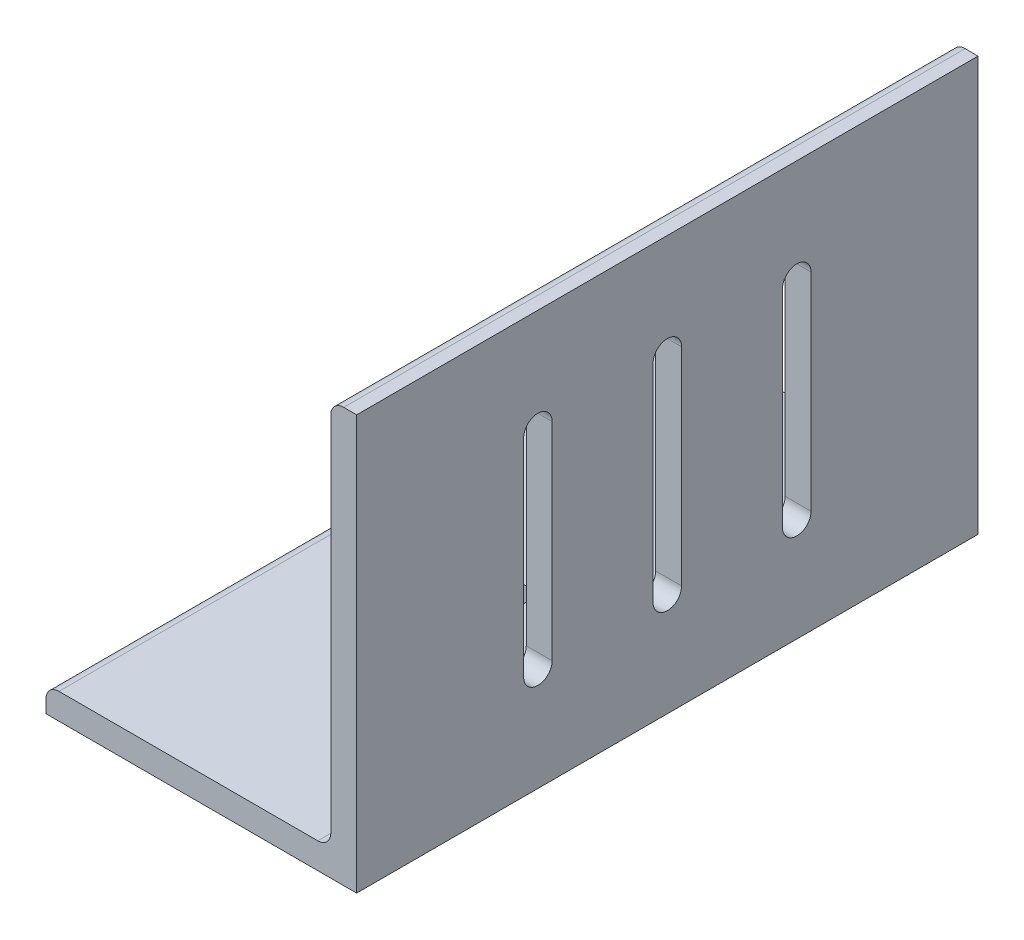
from build123d import *

# Parameters (mm, degrees)
BOSS_EXTRUDE1_DEPTH = 76.2
CUT_EXTRUDE1_DEPTH  = 10
SKETCH4_R           = 3.5
CUT_EXTRUDE2_DEPTH  = 10


with BuildPart() as part:
    # Sketch2 → Boss-Extrude1 (new, symmetric)
    with BuildSketch(Plane.XY):
        with BuildLine():
            Line((-38.1, 0), (38.1, 0))
            Line((38.1, 0), (38.1, 101.6))
            Line((38.1, 101.6), (34.925, 101.6))
            ThreePointArc((34.925, 101.6), (32.67993597, 100.67006403), (31.75, 98.425))
            Line((31.75, 98.425), (31.75, 9.525))
            ThreePointArc((31.75, 9.525), (30.82006403, 7.27993597), (28.575, 6.35))
            Line((28.575, 6.35), (-34.925, 6.35))
            ThreePointArc((-34.925, 6.35), (-37.17006403, 5.42006403), (-38.1, 3.175))
            Line((-38.1, 3.175), (-38.1, 0))
        make_face()
    extrude(amount=BOSS_EXTRUDE1_DEPTH, both=True)

    # Sketch3 → Cut-Extrude1 (cut)
    with BuildSketch(Plane(origin=(38.1, 0, 0), x_dir=(0, 0, -1), z_dir=(1, 0, 0))):
        with BuildLine():
            Line((-28.25, 76.2), (-28.25, 25.4))
            ThreePointArc((-28.25, 25.4), (-31.75, 21.9), (-35.25, 25.4))
            Line((-35.25, 25.4), (-35.25, 76.2))
            ThreePointArc((-35.25, 76.2), (-31.75, 79.7), (-28.25, 76.2))
        make_face()
        with BuildLine():
            Line((28.25, 76.2), (28.25, 25.4))
            ThreePointArc((28.25, 25.4), (31.75, 21.9), (35.25, 25.4))
            Line((35.25, 25.4), (35.25, 76.2))
            ThreePointArc((35.25, 76.2), (31.75, 79.7), (28.25, 76.2))
        make_face()
        with BuildLine():
            Line((3.5, 76.2), (3.5, 25.4))
            ThreePointArc((3.5, 25.4), (0, 21.9), (-3.5, 25.4))
            Line((-3.5, 25.4), (-3.5, 76.2))
            ThreePointArc((-3.5, 76.2), (0, 79.7), (3.5, 76.2))
        make_face()
    extrude(amount=-CUT_EXTRUDE1_DEPTH, mode=Mode.SUBTRACT)

    # Sketch4 → Cut-Extrude2 (cut)
    with BuildSketch(Plane.XZ):
        with Locations(Location((0, 25.4, 0), (0, 0, 270))):
            Circle(SKETCH4_R)
        with Locations((0, -25.4)):
            Circle(SKETCH4_R)
        with Locations(Location((0, 0, 0), (0, 0, 270))):
            Circle(SKETCH4_R)
    extrude(amount=-CUT_EXTRUDE2_DEPTH, mode=Mode.SUBTRACT)


solid = part.part
